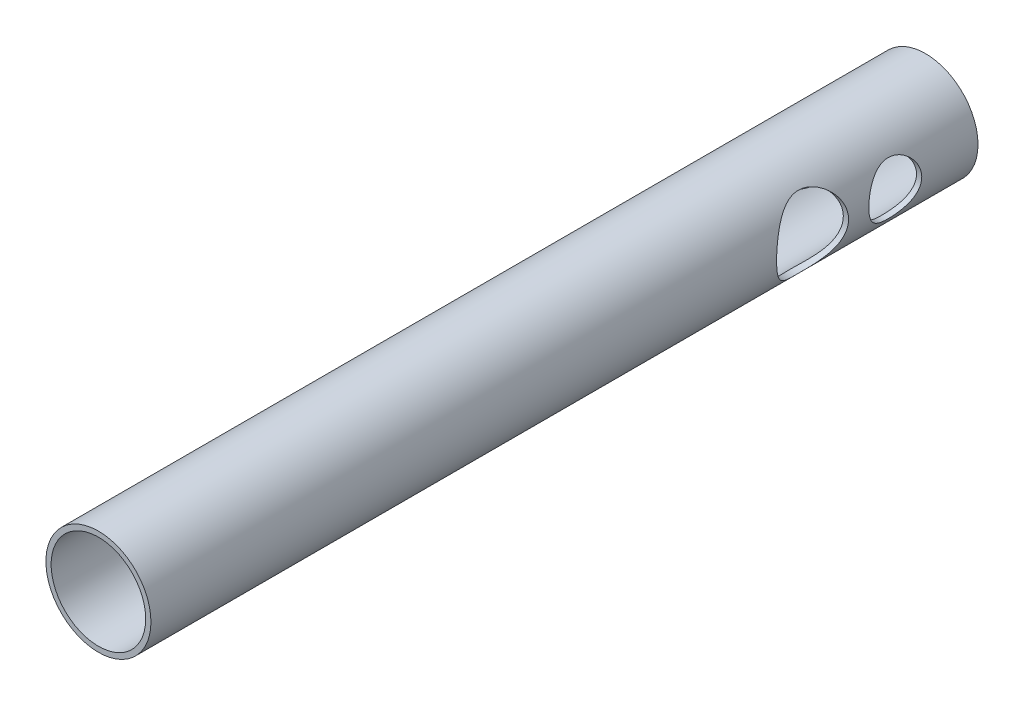
from build123d import *

# Parameters (mm, degrees)
BOSS_EXTRUDE1_DEPTH      = 250
BOSS_EXTRUDE1_DEPTH_BACK = 250
SKETCH1_R                = 31.75
SKETCH1_R_2              = 28.575
SKETCH2_R                = 21.75
SKETCH2_R_2              = 16
CUT_EXTRUDE1_DEPTH       = 255.000246063
SKETCH3_R                = 16
SKETCH3_R_2              = 21.75
CUT_EXTRUDE2_DEPTH       = 255.000246186


with BuildPart() as part:
    # Sketch1 → Boss-Extrude1 (new, two sides: drawn at the far end of the back side and taken through both)
    with BuildSketch(Plane.XY.offset(-BOSS_EXTRUDE1_DEPTH_BACK)):
        Circle(SKETCH1_R)
        Circle(SKETCH1_R_2, mode=Mode.SUBTRACT)
    extrude(amount=BOSS_EXTRUDE1_DEPTH + BOSS_EXTRUDE1_DEPTH_BACK)

    # Sketch2 → Cut-Extrude1 (cut, through all)
    with BuildSketch(Plane(origin=(0, 0, 0), x_dir=(0, 0, -1), z_dir=(1, 0, 0))):
        with Locations((200, 0)):
            Circle(SKETCH2_R)
        with Locations((150, 0)):
            Circle(SKETCH2_R_2)
    extrude(amount=-CUT_EXTRUDE1_DEPTH, mode=Mode.SUBTRACT)

    # Sketch3 → Cut-Extrude2 (cut, through all)
    with BuildSketch(Plane(origin=(0, 0, 0), x_dir=(0, 0, -1), z_dir=(1, 0, 0))):
        with Locations((200, 0)):
            Circle(SKETCH3_R)
        with Locations((150, 0)):
            Circle(SKETCH3_R_2)
    extrude(amount=CUT_EXTRUDE2_DEPTH, mode=Mode.SUBTRACT)


solid = part.part
